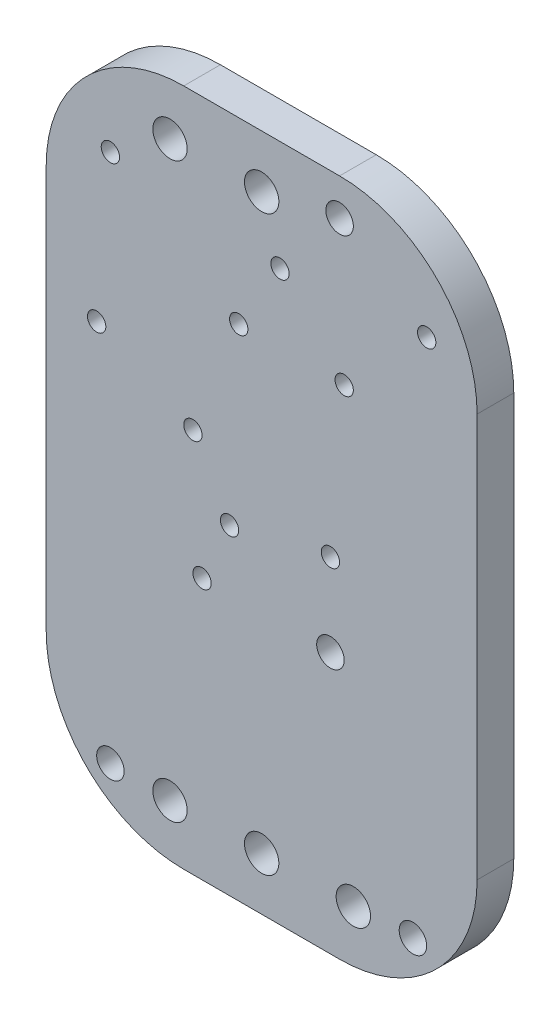
from build123d import *

# Parameters (mm, degrees)
BOARD_DEPTH            = 0.8
SKETCH2_R              = 0.3
SKETCH2_R_2            = 0.375
NON_PLATED_HOLES_DEPTH = 18.79719079
SKETCH3_R              = 0.2
SKETCH3_R_2            = 0.3
PLATED_HOLES_DEPTH     = 18.79719079


with BuildPart() as part:
    # Sketch1 → BOARD (new body)
    with BuildSketch(Plane.XY):
        with BuildLine():
            Line((0.3, 11.9), (0.3, 3.1))
            ThreePointArc((0.3, 3.1), (1.178679656, 0.978679656), (3.3, 0.1))
            Line((3.3, 0.1), (6.7, 0.1))
            ThreePointArc((6.7, 0.1), (8.821320344, 0.978679656), (9.7, 3.1))
            Line((9.7, 3.1), (9.7, 11.9))
            ThreePointArc((9.7, 11.9), (8.821320344, 14.021320344), (6.7, 14.9))
            Line((6.7, 14.9), (3.3, 14.9))
            ThreePointArc((3.3, 14.9), (1.178679656, 14.021320344), (0.3, 11.9))
        make_face()
    extrude(amount=BOARD_DEPTH)

    # Sketch2 → NON-PLATED HOLES (cut, through all)
    with BuildSketch(Plane.XY):
        with Locations((1.7, 1.3)):
            Circle(SKETCH2_R)
        with Locations((8.3, 1.3)):
            Circle(SKETCH2_R)
        with Locations((6.7, 14.1)):
            Circle(SKETCH2_R)
        with Locations((5, 13.75)):
            Circle(SKETCH2_R_2)
        with Locations((3, 13.75)):
            Circle(SKETCH2_R_2)
        with Locations((3, 1.25)):
            Circle(SKETCH2_R_2)
        with Locations((5, 1.25)):
            Circle(SKETCH2_R_2)
        with Locations((7, 1.25)):
            Circle(SKETCH2_R_2)
    extrude(amount=NON_PLATED_HOLES_DEPTH, mode=Mode.SUBTRACT)

    # Sketch3 → PLATED HOLES (cut, through all)
    with BuildSketch(Plane.XY):
        with Locations((4.5, 11)):
            Circle(SKETCH3_R)
        with Locations((1.4, 9.5)):
            Circle(SKETCH3_R)
        with Locations((8.6, 12.8)):
            Circle(SKETCH3_R)
        with Locations((1.7, 12.85)):
            Circle(SKETCH3_R)
        with Locations((3.5, 8.5)):
            Circle(SKETCH3_R)
        with Locations((3.7, 5.8)):
            Circle(SKETCH3_R)
        with Locations((6.8, 11)):
            Circle(SKETCH3_R)
        with Locations((6.5, 7.6)):
            Circle(SKETCH3_R)
        with Locations((6.5, 5.8)):
            Circle(SKETCH3_R_2)
        with Locations((4.3, 7.1)):
            Circle(SKETCH3_R)
        with Locations((5.4, 12.5)):
            Circle(SKETCH3_R)
    extrude(amount=PLATED_HOLES_DEPTH, mode=Mode.SUBTRACT)


solid = part.part
